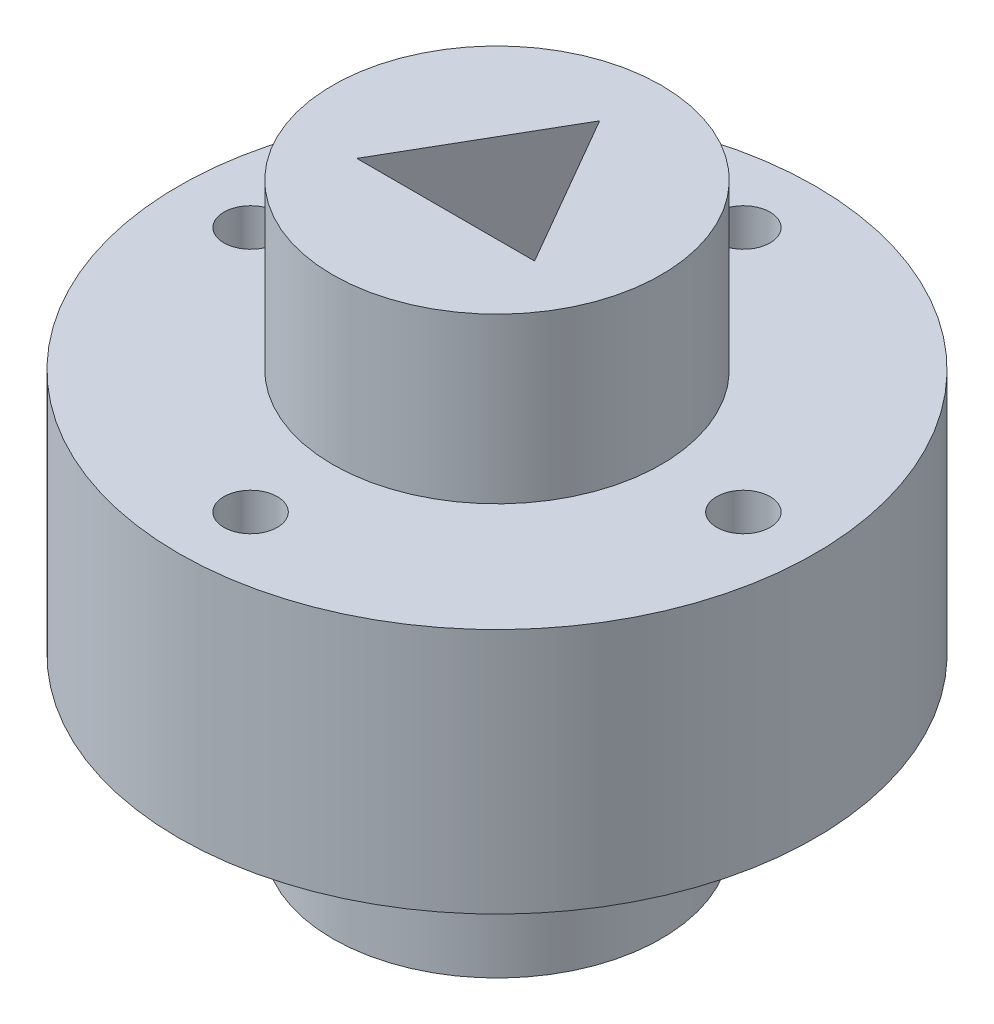
from build123d import *

# Parameters (mm, degrees)
SKETCH1_R           = 4
BOSS_EXTRUDE1_DEPTH = 4
SKETCH2_R           = 7.75
SKETCH2_R_2         = 0.65
BOSS_EXTRUDE2_DEPTH = 6
SKETCH3_R           = 4
BOSS_EXTRUDE3_DEPTH = 4
CUT_EXTRUDE1_DEPTH  = 24


with BuildPart() as part:
    # Sketch1 → Boss-Extrude1 (new body)
    with BuildSketch(Plane(origin=(0, 0, 0), x_dir=(1, 0, 0), z_dir=(0, 1, 0))):
        with Locations(Location((0, 0, 0), (0, 0, 270))):
            Circle(SKETCH1_R)
    extrude(amount=BOSS_EXTRUDE1_DEPTH)

    # Sketch2 → Boss-Extrude2 (add)
    with BuildSketch(Plane(origin=(0, 4, 0), x_dir=(1, 0, 0), z_dir=(0, 1, 0))):
        with Locations(Location((0, 0, 0), (0, 0, 270))):
            Circle(SKETCH2_R)
        with Locations(Location((0, 6, 0), (0, 0, 270))):
            Circle(SKETCH2_R_2, mode=Mode.SUBTRACT)
        with Locations(Location((6, 0, 0), (0, 0, 270))):
            Circle(SKETCH2_R_2, mode=Mode.SUBTRACT)
        with Locations(Location((0, -6, 0), (0, 0, 270))):
            Circle(SKETCH2_R_2, mode=Mode.SUBTRACT)
        with Locations(Location((-6, 0, 0), (0, 0, 270))):
            Circle(SKETCH2_R_2, mode=Mode.SUBTRACT)
    extrude(amount=BOSS_EXTRUDE2_DEPTH)

    # Sketch3 → Boss-Extrude3 (add)
    with BuildSketch(Plane(origin=(0, 10, 0), x_dir=(1, 0, 0), z_dir=(0, 1, 0))):
        with Locations(Location((0, 0, 0), (0, 0, 270))):
            Circle(SKETCH3_R)
    extrude(amount=BOSS_EXTRUDE3_DEPTH)

    # Sketch4 → Cut-Extrude1 (cut)
    with BuildSketch(Plane(origin=(0, 14, 0), x_dir=(1, 0, 0), z_dir=(0, 1, 0))):
        Polygon((0, 2.5), (2.165063509, -1.25), (-2.165063509, -1.25), align=None)
    extrude(amount=-CUT_EXTRUDE1_DEPTH, mode=Mode.SUBTRACT)


solid = part.part
